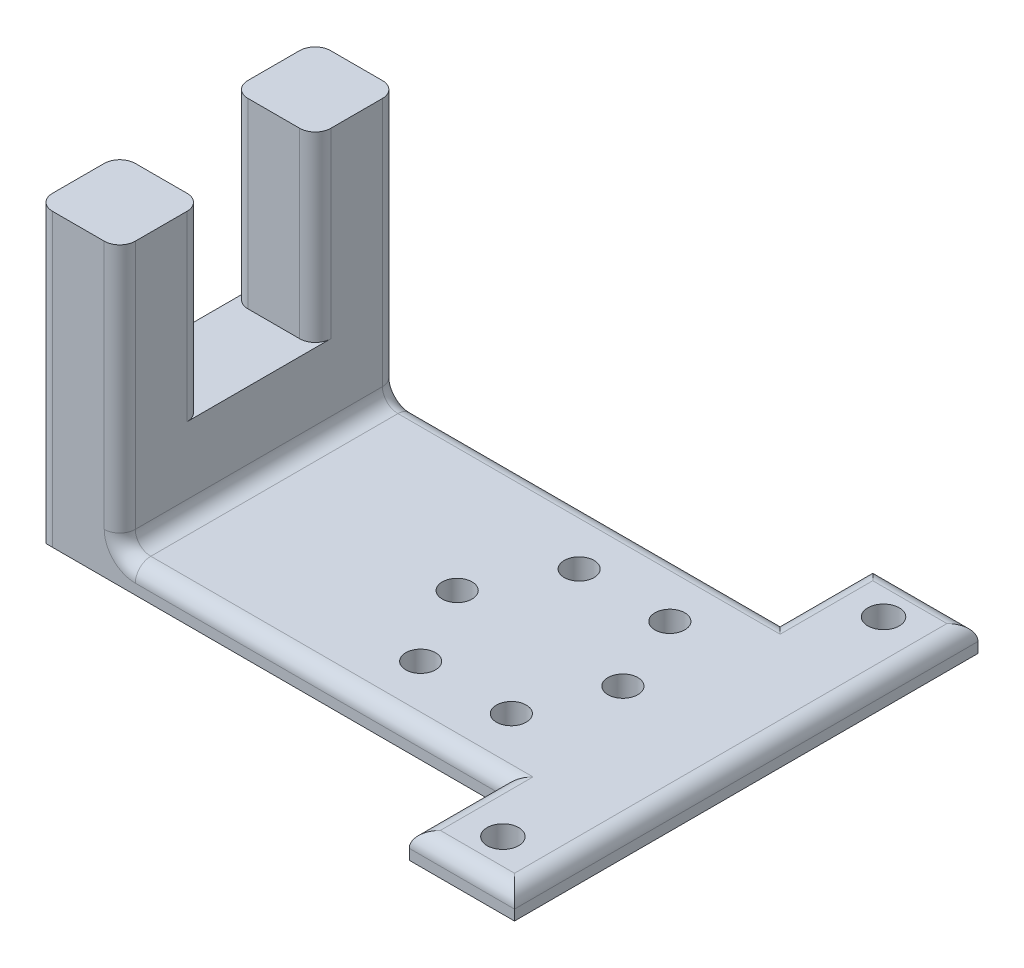
from build123d import *

# Parameters (mm, degrees)
SKETCH1_W           = 71.28
SKETCH1_H           = 42.64
BOSS_EXTRUDE1_DEPTH = 6.35
SKETCH3_W           = 12.7
SKETCH3_H           = 42.64
BOSS_EXTRUDE3_DEPTH = 12.7
SKETCH4_W           = 12.7
SKETCH4_H           = 12.7
BOSS_EXTRUDE4_DEPTH = 27.94
SKETCH6_W           = 12.7
SKETCH6_H           = 12.676175504
BOSS_EXTRUDE5_DEPTH = 27.94
SKETCH7_R           = 2.286
SKETCH7_R_2         = 2.285
CUT_EXTRUDE1_DEPTH  = 63.267019151
SKETCH10_W          = 16.129
SKETCH10_H          = 71.046005576
BOSS_EXTRUDE6_DEPTH = 6.35
SKETCH11_R          = 2.413
CUT_EXTRUDE2_DEPTH  = 6.35
CHAMFER1_SIZE       = 2.38
FILLET1_R           = 2.38


with BuildPart() as part:
    # Sketch1 → Boss-Extrude1 (new body)
    with BuildSketch(Plane(origin=(0, 0, 0), x_dir=(1, 0, 0), z_dir=(0, 1, 0))):
        with Locations((-1.22975773, -8.11115762)):
            Rectangle(SKETCH1_W, SKETCH1_H)
    extrude(amount=BOSS_EXTRUDE1_DEPTH)

    # Sketch3 → Boss-Extrude3 (add)
    with BuildSketch(Plane(origin=(0, 6.35, 0), x_dir=(1, 0, 0), z_dir=(0, 1, 0))):
        with Locations((-30.51975773, -8.11115762)):
            Rectangle(SKETCH3_W, SKETCH3_H)
    extrude(amount=BOSS_EXTRUDE3_DEPTH)

    # Sketch4 → Boss-Extrude4 (add)
    with BuildSketch(Plane(origin=(0, 19.05, 0), x_dir=(1, 0, 0), z_dir=(0, 1, 0))):
        with Locations((-30.51975773, -23.08115762)):
            Rectangle(SKETCH4_W, SKETCH4_H)
    extrude(amount=BOSS_EXTRUDE4_DEPTH)

    # Sketch6 → Boss-Extrude5 (add)
    with BuildSketch(Plane(origin=(0, 19.05, 0), x_dir=(1, 0, 0), z_dir=(0, 1, 0))):
        with Locations((-30.51975773, 6.870754628)):
            Rectangle(SKETCH6_W, SKETCH6_H)
    extrude(amount=BOSS_EXTRUDE5_DEPTH)

    # Sketch7 → Cut-Extrude1 (cut, through all)
    with BuildSketch(Plane(origin=(0, 6.35, 0), x_dir=(1, 0, 0), z_dir=(0, 1, 0))):
        with Locations(Location((6.23024227, -8.11115762, 0), (0, 0, 270))):
            Circle(SKETCH7_R)
        with Locations(Location((31.63024227, -8.11115762, 0), (0, 0, 270))):
            Circle(SKETCH7_R)
        with Locations(Location((12.73024227, 4.08884238, 0), (0, 0, 270))):
            Circle(SKETCH7_R_2)
        with Locations(Location((12.83024227, -20.31115762, 0), (0, 0, 270))):
            Circle(SKETCH7_R_2)
        with Locations(Location((26.63024227, 4.08884238, 0), (0, 0, 270))):
            Circle(SKETCH7_R_2)
        with Locations(Location((26.73024227, -20.31115762, 0), (0, 0, 270))):
            Circle(SKETCH7_R_2)
    extrude(amount=-CUT_EXTRUDE1_DEPTH, mode=Mode.SUBTRACT)

    # Sketch10 → Boss-Extrude6 (add)
    with BuildSketch(Plane(origin=(0, 6.35, 0), x_dir=(1, 0, 0), z_dir=(0, 1, 0))):
        with Locations((42.47474227, -8.11115762)):
            Rectangle(SKETCH10_W, SKETCH10_H)
    extrude(amount=-BOSS_EXTRUDE6_DEPTH)

    # Sketch11 → Cut-Extrude2 (cut)
    with BuildSketch(Plane(origin=(0, 6.35, 0), x_dir=(1, 0, 0), z_dir=(0, 1, 0))):
        with Locations(Location((42.41124227, 21.061845168, 0), (0, 0, 270))):
            Circle(SKETCH11_R)
        with Locations(Location((42.41124227, -37.284160408, 0), (0, 0, 270))):
            Circle(SKETCH11_R)
    extrude(amount=-CUT_EXTRUDE2_DEPTH, mode=Mode.SUBTRACT)

    # Chamfer1
    chamfer1_edges = [part.edges().sort_by_distance(p)[0] for p in [
        (-1.22975773, 0, 29.43115762),
        (-36.86975773, 0, 8.11115762),
        (-1.22975773, 0, -13.20884238),
        (34.41024227, 0, -20.310343774),
        (34.41024227, 0, 36.532659014),
        (42.47474227, 0, -27.411845168),
        (50.53924227, 0, 8.11115762),
        (42.47474227, 0, 43.634160408),
    ]]
    chamfer(chamfer1_edges, length=CHAMFER1_SIZE)

    # Fillet1
    fillet1_edges = [part.edges().sort_by_distance(p)[0] for p in [
        (5.12024227, 6.35, 29.43115762),
        (-24.16975773, 6.35, 8.11115762),
        (-24.16975773, 26.67, 29.43115762),
        (-24.16975773, 26.67, -13.20884238),
        (-24.16975773, 33.02, 16.73115762),
        (-36.86975773, 33.02, 16.73115762),
        (-36.86975773, 33.02, -0.532666876),
        (-24.16975773, 33.02, -0.532666876),
        (5.12024227, 6.35, -13.20884238),
        (-36.86975773, 24.685, 29.43115762),
        (-36.86975773, 24.685, -13.20884238),
        (34.41024227, 6.35, -20.310343774),
        (34.41024227, 6.35, 36.532659014),
        (42.47474227, 6.35, 43.634160408),
        (50.53924227, 6.35, 8.11115762),
        (42.47474227, 6.35, -27.411845168),
    ]]
    fillet(fillet1_edges, radius=FILLET1_R)


solid = part.part
